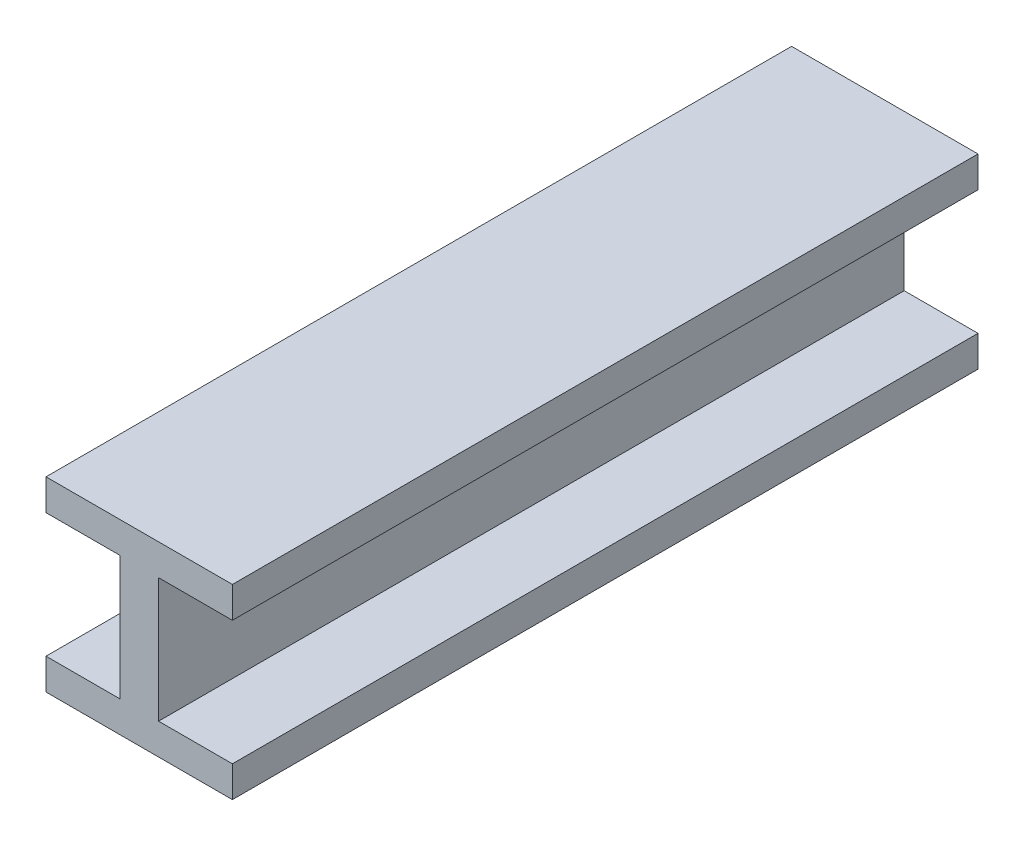
from build123d import *

# Parameters (mm, degrees)
BOSS_EXTRUDE2_DEPTH = 76.2


with BuildPart() as part:
    # Sketch1 → Boss-Extrude2 (new, symmetric)
    with BuildSketch(Plane.XY):
        Polygon((3.96875, 12.7), (3.96875, -12.7), (19.05, -12.7), (19.05, -19.05), (-19.05, -19.05), (-19.05, -12.7), (-3.96875, -12.7), (-3.96875, 12.7), (-19.05, 12.7), (-19.05, 19.05), (19.05, 19.05), (19.05, 12.7), align=None)
    extrude(amount=BOSS_EXTRUDE2_DEPTH, both=True)


solid = part.part
